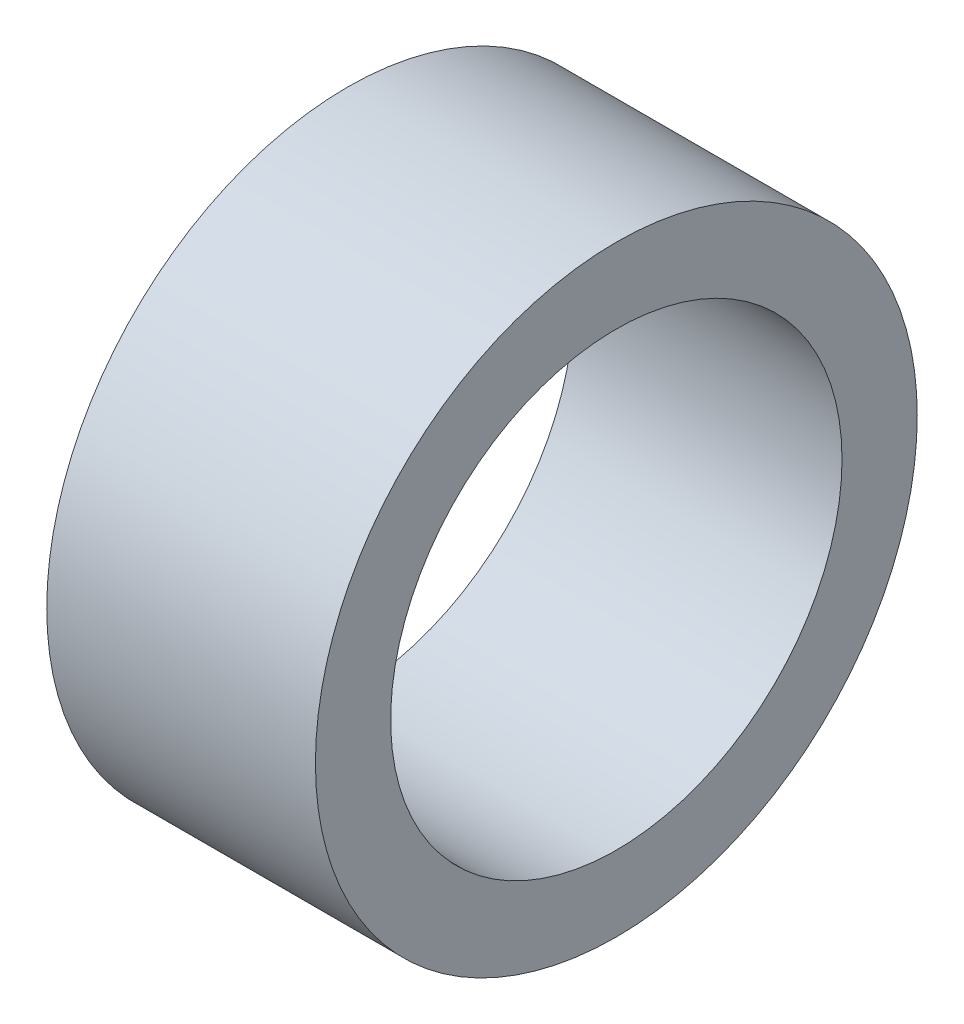
from build123d import *

# Parameters (mm, degrees)
ESQUISSE1_R        = 2.8
ESQUISSE1_R_2      = 2.1
BOSS_EXTRU_1_DEPTH = 1.25


with BuildPart() as part:
    # Esquisse1 → Boss.-Extru.1 (new, symmetric)
    with BuildSketch(Plane(origin=(0, 0, 0), x_dir=(0, 0, -1), z_dir=(1, 0, 0))):
        Circle(ESQUISSE1_R)
        Circle(ESQUISSE1_R_2, mode=Mode.SUBTRACT)
    extrude(amount=BOSS_EXTRU_1_DEPTH, both=True)


solid = part.part
